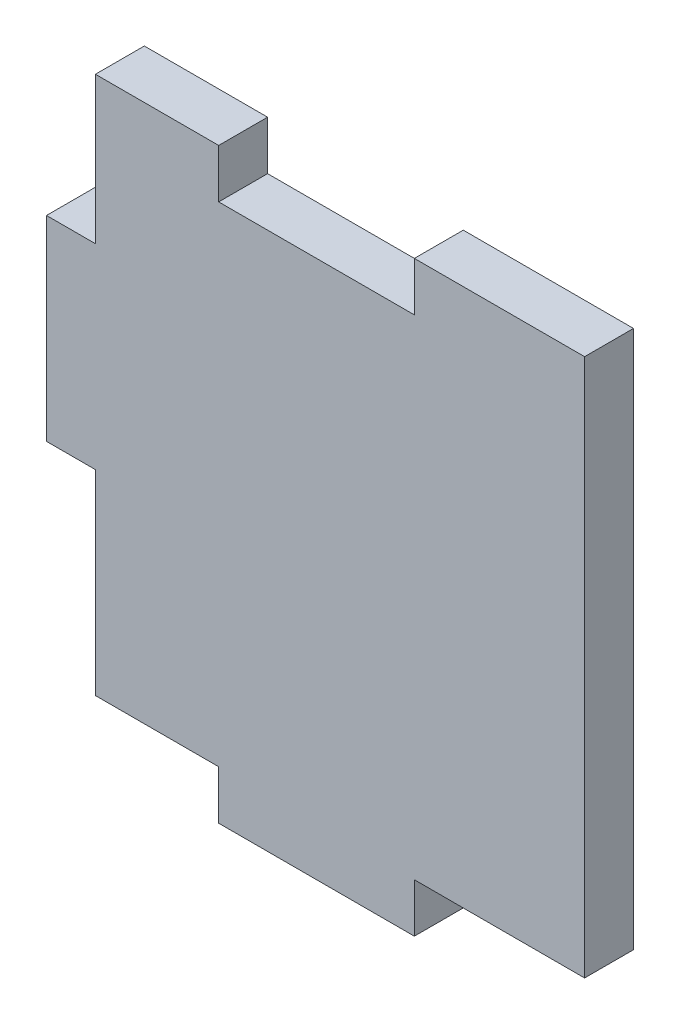
from build123d import *

# Parameters (mm, degrees)
EXTRUDE1_DEPTH = 6.35


with BuildPart() as part:
    # Sketch1 → Extrude1 (new body)
    with BuildSketch(Plane.XY):
        Polygon((0, 6.35), (16.002, 6.35), (16.002, 0), (41.402, 0), (41.402, 6.35), (63.5, 6.35), (63.5, 76.2), (41.402, 76.2), (41.402, 69.85), (16.002, 69.85), (16.002, 76.2), (0, 76.2), (0, 57.15), (-6.35, 57.15), (-6.35, 31.75), (0, 31.75), align=None)
    extrude(amount=EXTRUDE1_DEPTH)


solid = part.part
